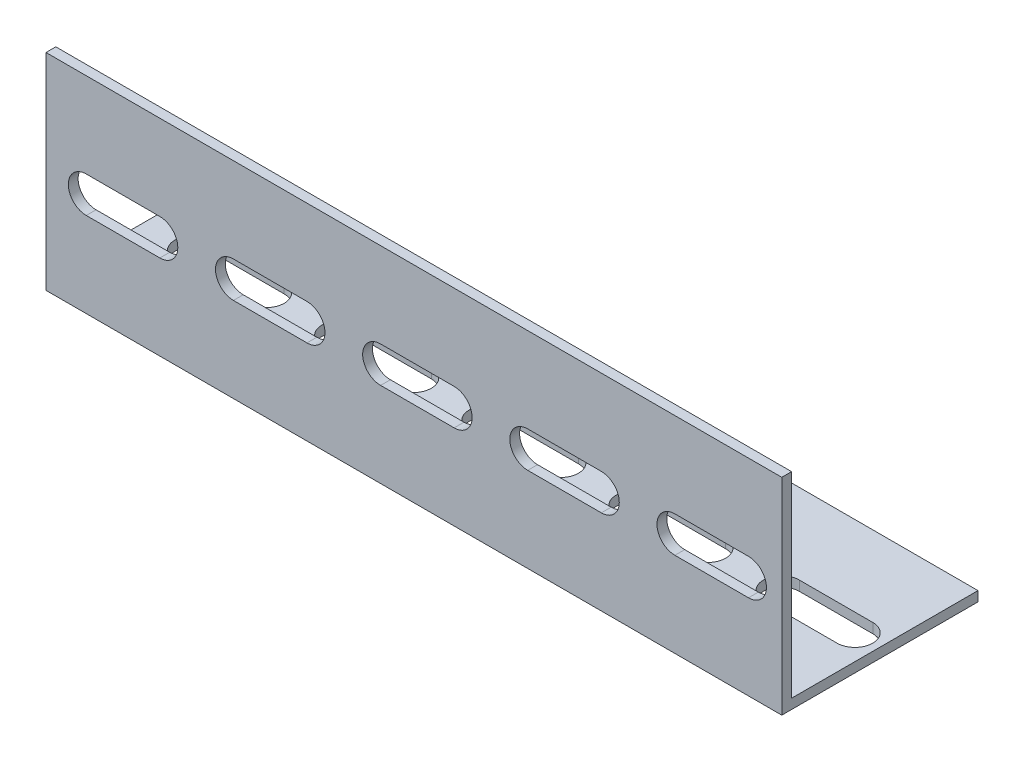
from build123d import *

# Parameters (mm, degrees)
SKETCH1_W           = 150
SKETCH1_H           = 40
BOSS_EXTRUDE1_DEPTH = 2
SKETCH2_W           = 150
SKETCH2_H           = 2
BOSS_EXTRUDE2_DEPTH = 40
CUT_EXTRUDE2_DEPTH  = 10
CUT_EXTRUDE4_DEPTH  = 10


with BuildPart() as part:
    # Sketch1 → Boss-Extrude1 (new body)
    with BuildSketch(Plane(origin=(0, 0, 0), x_dir=(1, 0, 0), z_dir=(0, 1, 0))):
        Rectangle(SKETCH1_W, SKETCH1_H)
    extrude(amount=BOSS_EXTRUDE1_DEPTH)

    # Sketch2 → Boss-Extrude2 (add)
    with BuildSketch(Plane(origin=(0, 2, 0), x_dir=(1, 0, 0), z_dir=(0, 1, 0))):
        with Locations((0, -19)):
            Rectangle(SKETCH2_W, SKETCH2_H)
    extrude(amount=BOSS_EXTRUDE2_DEPTH)

    # Sketch3 → Cut-Extrude2 (cut)
    with BuildSketch(Plane.XY.offset(20)):
        with BuildLine():
            Line((-36.788952994, 24.648821368), (-21.788952994, 24.648821368))
            ThreePointArc((-21.788952994, 24.648821368), (-18.13017777, 20.990046144), (-21.788952994, 17.33127092))
            Line((-21.788952994, 17.33127092), (-36.788952994, 17.33127092))
            ThreePointArc((-36.788952994, 17.33127092), (-40.447728218, 20.990046144), (-36.788952994, 24.648821368))
        make_face()
        with BuildLine():
            Line((-66.788952994, 24.648821368), (-51.788952994, 24.648821368))
            ThreePointArc((-51.788952994, 24.648821368), (-48.13017777, 20.990046144), (-51.788952994, 17.33127092))
            Line((-51.788952994, 17.33127092), (-66.788952994, 17.33127092))
            ThreePointArc((-66.788952994, 17.33127092), (-70.447728218, 20.990046144), (-66.788952994, 24.648821368))
        make_face()
        with BuildLine():
            Line((-6.788952994, 24.648821368), (8.211047006, 24.648821368))
            ThreePointArc((8.211047006, 24.648821368), (11.86982223, 20.990046144), (8.211047006, 17.33127092))
            Line((8.211047006, 17.33127092), (-6.788952994, 17.33127092))
            ThreePointArc((-6.788952994, 17.33127092), (-10.447728218, 20.990046144), (-6.788952994, 24.648821368))
        make_face()
        with BuildLine():
            Line((23.211047006, 24.648821368), (38.211047006, 24.648821368))
            ThreePointArc((38.211047006, 24.648821368), (41.86982223, 20.990046144), (38.211047006, 17.33127092))
            Line((38.211047006, 17.33127092), (23.211047006, 17.33127092))
            ThreePointArc((23.211047006, 17.33127092), (19.552271782, 20.990046144), (23.211047006, 24.648821368))
        make_face()
        with BuildLine():
            Line((53.211047006, 24.648821368), (68.211047006, 24.648821368))
            ThreePointArc((68.211047006, 24.648821368), (71.86982223, 20.990046144), (68.211047006, 17.33127092))
            Line((68.211047006, 17.33127092), (53.211047006, 17.33127092))
            ThreePointArc((53.211047006, 17.33127092), (49.552271782, 20.990046144), (53.211047006, 24.648821368))
        make_face()
    extrude(amount=-CUT_EXTRUDE2_DEPTH, mode=Mode.SUBTRACT)

    # Sketch4 → Cut-Extrude4 (cut)
    with BuildSketch(Plane.XZ):
        with BuildLine():
            Line((-35.090017562, 3.65), (-20.090017562, 3.65))
            ThreePointArc((-20.090017562, 3.65), (-16.440017562, 0), (-20.090017562, -3.65))
            Line((-20.090017562, -3.65), (-35.090017562, -3.65))
            ThreePointArc((-35.090017562, -3.65), (-38.740017562, 0), (-35.090017562, 3.65))
        make_face()
        with BuildLine():
            Line((-65.090017562, 3.65), (-50.090017562, 3.65))
            ThreePointArc((-50.090017562, 3.65), (-46.440017562, 0), (-50.090017562, -3.65))
            Line((-50.090017562, -3.65), (-65.090017562, -3.65))
            ThreePointArc((-65.090017562, -3.65), (-68.740017562, 0), (-65.090017562, 3.65))
        make_face()
        with BuildLine():
            Line((-5.090017562, 3.65), (9.909982438, 3.65))
            ThreePointArc((9.909982438, 3.65), (13.559982438, 0), (9.909982438, -3.65))
            Line((9.909982438, -3.65), (-5.090017562, -3.65))
            ThreePointArc((-5.090017562, -3.65), (-8.740017562, 0), (-5.090017562, 3.65))
        make_face()
        with BuildLine():
            Line((24.909982438, 3.65), (39.909982438, 3.65))
            ThreePointArc((39.909982438, 3.65), (43.559982438, 0), (39.909982438, -3.65))
            Line((39.909982438, -3.65), (24.909982438, -3.65))
            ThreePointArc((24.909982438, -3.65), (21.259982438, 0), (24.909982438, 3.65))
        make_face()
        with BuildLine():
            Line((54.909982438, 3.65), (69.909982438, 3.65))
            ThreePointArc((69.909982438, 3.65), (73.559982438, 0), (69.909982438, -3.65))
            Line((69.909982438, -3.65), (54.909982438, -3.65))
            ThreePointArc((54.909982438, -3.65), (51.259982438, 0), (54.909982438, 3.65))
        make_face()
    extrude(amount=-CUT_EXTRUDE4_DEPTH, mode=Mode.SUBTRACT)


solid = part.part
